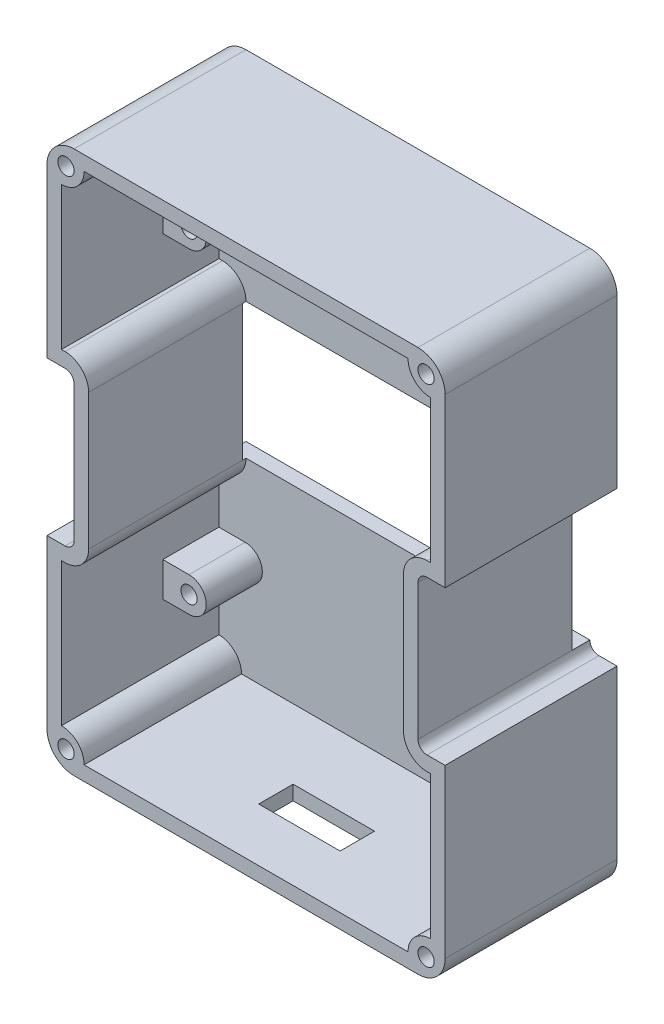
from build123d import *

# Parameters (mm, degrees)
SKETCH_1_W               = 44
SKETCH_1_H               = 60
EXTRUDE_1_DEPTH          = 19
SKETCH_2_W               = 3
SKETCH_2_H               = 17
CUT_EXTRUDE_1_DEPTH      = 42.773197148
FILLET_1_R               = 3
FILLET_2_R               = 1
SHELL_1_T                = -1.6
EXTRUDE_2_DEPTH          = 17.4
SKETCH_3_3_R             = 0.9
CUT_EXTRUDE_2_DEPTH      = 17.4
MIRROR_2_COPY_1_DEPTH    = 17.4
MIRROR_2_COPY_2_SKETCH_R = 0.9
MIRROR_2_COPY_2_DEPTH    = 17.4
SKETCH_4_W               = 6.8
SKETCH_4_H               = 15
EXTRUDE_3_DEPTH          = 6.2
CUT_EXTRUDE_3_DEPTH      = 42.070183832
CUT_EXTRUDE_3_DEPTH_BACK = 42.070183832
SKETCH_4_4_W             = 2
SKETCH_4_4_H             = 1.7
SKETCH_5_R               = 0.9
EXTRUDE_4_DEPTH          = 6.2
SKETCH_6_W               = 9
SKETCH_6_H               = 3.8
CUT_EXTRUDE_4_DEPTH      = 66.234653368
SKETCH_7_W               = 38
SKETCH_7_H               = 15
CUT_EXTRUDE_5_DEPTH      = 2


with BuildPart() as part:
    # 草图1 → 凸台-拉伸1 (new body)
    with BuildSketch(Plane.XY):
        Rectangle(SKETCH_1_W, SKETCH_1_H)
    extrude(amount=EXTRUDE_1_DEPTH)

    # 草图2 → 切除-拉伸1 (cut, through all)
    with BuildSketch(Plane.XY.offset(19)):
        with Locations((-20.5, 0)):
            Rectangle(SKETCH_2_W, SKETCH_2_H)
        with Locations((20.5, 0)):
            Rectangle(SKETCH_2_W, SKETCH_2_H)
    extrude(amount=-CUT_EXTRUDE_1_DEPTH, mode=Mode.SUBTRACT)

    # 圆角1
    fillet_1_edges = [part.edges().sort_by_distance(p)[0] for p in [
        (22, -30, 9.5),
        (-22, -30, 9.5),
        (-22, 30, 9.5),
        (22, 30, 9.5),
    ]]
    fillet(fillet_1_edges, radius=FILLET_1_R)

    # 圆角2
    fillet_2_edges = [part.edges().sort_by_distance(p)[0] for p in [
        (-19, 8.5, 9.5),
        (-19, -8.5, 9.5),
        (19, -8.5, 9.5),
        (19, 8.5, 9.5),
    ]]
    fillet(fillet_2_edges, radius=FILLET_2_R)

    # 抽壳1
    shell_1_openings = [part.faces().sort_by_distance(p)[0] for p in [
        (0, 0, 19),
    ]]
    offset(amount=SHELL_1_T, openings=shell_1_openings, kind=Kind.INTERSECTION)

    # 草图3 → 凸台-拉伸2 (add)
    with BuildSketch(Plane.XY.offset(1.6)):
        with BuildLine():
            Line((-20.4, 28.4), (-17.9, 28.4))
            ThreePointArc((-17.9, 28.4), (-18.632233047, 26.632233047), (-20.4, 25.9))
            Line((-20.4, 25.9), (-20.4, 28.4))
        make_face()
    extrude_2 = extrude(amount=EXTRUDE_2_DEPTH)

    # 草图3<3> → 切除-拉伸2 (cut)
    with BuildSketch(Plane.XY.offset(1.6)):
        with Locations(Location((-19.9, 27.9, 0), (0, 0, 180))):
            Circle(SKETCH_3_3_R)
    cut_extrude_2 = extrude(amount=CUT_EXTRUDE_2_DEPTH, mode=Mode.SUBTRACT)

    # 镜向1: 凸台-拉伸2, 切除-拉伸2 across plane
    add(extrude_2.mirror(Plane(origin=(0, 0, 0), x_dir=(0, 0, 1), z_dir=(1, 0, 0))))
    add(cut_extrude_2.mirror(Plane(origin=(0, 0, 0), x_dir=(0, 0, 1), z_dir=(1, 0, 0))), mode=Mode.SUBTRACT)

    # 镜向2: 凸台-拉伸2, 切除-拉伸2 across plane
    add(extrude_2.mirror(Plane.ZX))
    add(cut_extrude_2.mirror(Plane.ZX), mode=Mode.SUBTRACT)

    # 镜向2 copy 1 sketch → 镜向2 copy 1 (add)
    with BuildSketch(Plane(origin=(0, 0, 1.6), x_dir=(-1, 0, 0), z_dir=(0, 0, 1))):
        with BuildLine():
            Line((-20.4, 28.4), (-17.9, 28.4))
            ThreePointArc((-17.9, 28.4), (-18.632233047, 26.632233047), (-20.4, 25.9))
            Line((-20.4, 25.9), (-20.4, 28.4))
        make_face()
    extrude(amount=MIRROR_2_COPY_1_DEPTH)

    # 镜向2 copy 2 sketch → 镜向2 copy 2 (cut)
    with BuildSketch(Plane(origin=(0, 0, 1.6), x_dir=(-1, 0, 0), z_dir=(0, 0, 1))):
        with Locations(Location((-19.9, 27.9, 0), (0, 0, 180))):
            Circle(MIRROR_2_COPY_2_SKETCH_R)
    extrude(amount=MIRROR_2_COPY_2_DEPTH, mode=Mode.SUBTRACT)

    # 草图4 → 凸台-拉伸3 (add)
    with BuildSketch(Plane.XY.offset(1.6)):
        with Locations((17, -20.9)):
            Rectangle(SKETCH_4_W, SKETCH_4_H)
    extrude(amount=EXTRUDE_3_DEPTH)

    # 草图4<4> → 切除-拉伸3 (cut, two sides: drawn at the far end of the back side and taken through both)
    with BuildSketch(Plane.XY.offset(1.6).offset(-CUT_EXTRUDE_3_DEPTH_BACK)):
        with Locations((16.2, -26.15)):
            Rectangle(SKETCH_4_4_W, SKETCH_4_4_H)
        with Locations((16.2, -23.61)):
            Rectangle(SKETCH_4_4_W, SKETCH_4_4_H)
        with Locations((16.2, -21.07)):
            Rectangle(SKETCH_4_4_W, SKETCH_4_4_H)
        with Locations((16.2, -18.53)):
            Rectangle(SKETCH_4_4_W, SKETCH_4_4_H)
        with Locations((16.2, -15.99)):
            Rectangle(SKETCH_4_4_W, SKETCH_4_4_H)
    extrude(amount=CUT_EXTRUDE_3_DEPTH + CUT_EXTRUDE_3_DEPTH_BACK, mode=Mode.SUBTRACT)

    # 草图5 → 凸台-拉伸4 (add)
    # profile 1 of 3: a face of its own
    with BuildSketch(Plane.XY.offset(1.6)):
        with BuildLine():
            Line((-17.5, 19.4), (-20.4, 19.4))
            Line((-20.4, 19.4), (-20.4, 15.6))
            Line((-20.4, 15.6), (-17.5, 15.6))
            ThreePointArc((-17.5, 15.6), (-15.6, 17.5), (-17.5, 19.4))
        make_face()
        with Locations(Location((-17.5, 17.5, 0), (0, 0, 180))):
            Circle(SKETCH_5_R, mode=Mode.SUBTRACT)
    # profile 2 of 3: a face of its own
    with BuildSketch(Plane.XY.offset(1.6)):
        with BuildLine():
            Line((20.4, 15.6), (17.5, 15.6))
            ThreePointArc((17.5, 15.6), (15.6, 17.5), (17.5, 19.4))
            Line((17.5, 19.4), (20.4, 19.4))
            Line((20.4, 19.4), (20.4, 15.6))
        make_face()
        with Locations(Location((17.5, 17.5, 0), (0, 0, 180))):
            Circle(SKETCH_5_R, mode=Mode.SUBTRACT)
    # profile 3 of 3: a face of its own
    with BuildSketch(Plane.XY.offset(1.6)):
        with BuildLine():
            Line((-20.4, -15.6), (-17.5, -15.6))
            ThreePointArc((-17.5, -15.6), (-15.6, -17.5), (-17.5, -19.4))
            Line((-17.5, -19.4), (-20.4, -19.4))
            Line((-20.4, -19.4), (-20.4, -15.6))
        make_face()
        with Locations(Location((-17.5, -17.5, 0), (0, 0, 180))):
            Circle(SKETCH_5_R, mode=Mode.SUBTRACT)
    extrude(amount=EXTRUDE_4_DEPTH)

    # 草图6 → 切除-拉伸4 (cut, through all)
    with BuildSketch(Plane(origin=(0, -28.4, 0), x_dir=(1, 0, 0), z_dir=(0, 1, 0))):
        with Locations((0, -11.2)):
            Rectangle(SKETCH_6_W, SKETCH_6_H)
    extrude(amount=-CUT_EXTRUDE_4_DEPTH, mode=Mode.SUBTRACT)

    # 草图7 → 切除-拉伸5 (cut)
    with BuildSketch(Plane(origin=(0, 0, 0), x_dir=(-1, 0, 0), z_dir=(0, 0, -1))):
        Rectangle(SKETCH_7_W, SKETCH_7_H)
    extrude(amount=-CUT_EXTRUDE_5_DEPTH, mode=Mode.SUBTRACT)


solid = part.part
